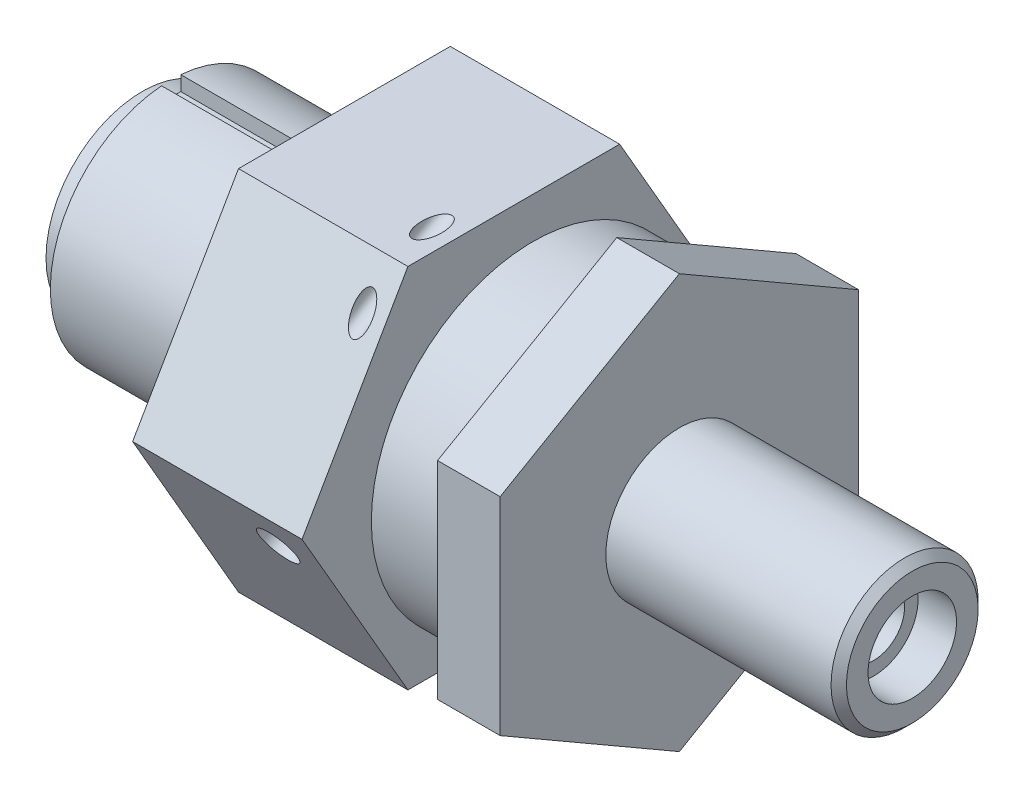
from build123d import *

# Parameters (mm, degrees)
CHAMFER1_SIZE           = 0.4
EXTRUDE1_START          = -3.25
SKETCH2_R               = 11.925743973
EXTRUDE1_DEPTH          = 3.25
EXTRUDE2_START          = -8.8
SKETCH3_R               = 13.491172398
EXTRUDE2_DEPTH          = 8.8
SKETCH4_W               = 1
SKETCH4_H               = 1.144643989
EXTRUDE3_DEPTH          = 9.5
CUT_EXTRUDE1_DEPTH      = 48.023611133
CUT_EXTRUDE1_DEPTH_BACK = 48.023611133
SKETCH5_R               = 0.520703833
SKETCH6_R               = 1.016043674
CUT_EXTRUDE2_DEPTH      = 0.5
CUT_EXTRUDE3_START      = -0.5
SKETCH7_R               = 1.016043674
CUT_EXTRUDE3_DEPTH      = 0.5


with BuildPart() as part:
    # Sketch1 → Revolve1 (revolve)
    with BuildSketch(Plane.XY, mode=Mode.PRIVATE) as revolve1_sk:
        Polygon((0, 0), (0, 5), (1.5, 5), (1.5, 6.275), (11, 6.275), (11, 8.75), (10.5, 8.75), (10.5, 11), (19.3, 11), (19.3, 6.5), (20.3, 6.5), (20.3, 8.4), (24.65, 8.4), (24.65, 10.75), (27.9, 10.75), (27.9, 3.82), (40, 3.82), (40, 2.3), (38, 2.3), (38, 1.6), (12, 1.6), (12, 0), align=None)
    revolve(revolve1_sk.sketch.rotate(Axis((0, 0, 0), (1, 0, 0)), 90), axis=Axis((0, 0, 0), (1, 0, 0)))

    # Chamfer1
    chamfer1_edges = [part.edges().sort_by_distance(p)[0] for p in [
        (40, 0, -3.82),
    ]]
    chamfer(chamfer1_edges, length=CHAMFER1_SIZE)

    # Sketch2 → Extrude1 (cut)
    with BuildSketch(Plane(origin=(27.9, 0, 0), x_dir=(0, 0, -1), z_dir=(1, 0, 0)).offset(EXTRUDE1_START)):
        Circle(SKETCH2_R)
        Polygon((0, 10.75), (-9.309773091, 5.375), (-9.309773091, -5.375), (0, -10.75), (9.309773091, -5.375), (9.309773091, 5.375), align=None, mode=Mode.SUBTRACT)
    extrude(amount=EXTRUDE1_DEPTH, mode=Mode.SUBTRACT)

    # Sketch3 → Extrude2 (cut)
    with BuildSketch(Plane(origin=(19.3, 0, 0), x_dir=(0, 0, -1), z_dir=(1, 0, 0)).offset(EXTRUDE2_START)):
        Circle(SKETCH3_R)
        Polygon((-5.5, 9.526279442), (-11, 0), (-5.5, -9.526279442), (5.5, -9.526279442), (11, 0), (5.5, 9.526279442), align=None, mode=Mode.SUBTRACT)
    extrude(amount=EXTRUDE2_DEPTH, mode=Mode.SUBTRACT)

    # Sketch4 → Extrude3 (cut)
    with BuildSketch(Plane.ZY.offset(-1.5)):
        with Locations((0, 6.063519509)):
            Rectangle(SKETCH4_W, SKETCH4_H)
    extrude(amount=-EXTRUDE3_DEPTH, mode=Mode.SUBTRACT)

    # Sketch5 → Cut-Extrude1 (cut, two sides: drawn at the far end of the back side and taken through both)
    with BuildSketch(Plane(origin=(0, -4.763139721, 8.25), x_dir=(1, 0, 0), z_dir=(0, -0.5000000000000002, 0.8660254037844386)).offset(-CUT_EXTRUDE1_DEPTH_BACK)):
        with Locations(Location((18.145997854, 9.8, 0), (0, 0, 270))):
            Circle(SKETCH5_R)
    extrude(amount=CUT_EXTRUDE1_DEPTH + CUT_EXTRUDE1_DEPTH_BACK, mode=Mode.SUBTRACT)

    # Sketch6 → Cut-Extrude2 (cut)
    with BuildSketch(Plane(origin=(0, -4.763139721, 8.25), x_dir=(1, 0, 0), z_dir=(0, -0.5000000000000002, 0.8660254037844386))):
        with Locations(Location((16.808700708, 2.994097786, 0), (0, 0, 270))):
            Circle(SKETCH6_R)
    extrude(amount=-CUT_EXTRUDE2_DEPTH, mode=Mode.SUBTRACT)

    # Sketch7 → Cut-Extrude3 (cut)
    with BuildSketch(Plane(origin=(0, 4.763139721, -8.25), x_dir=(-1, 0, 0), z_dir=(0, 0.49999999999999944, -0.8660254037844389)).offset(CUT_EXTRUDE3_START)):
        with Locations(Location((-16.808700708, 2.994097786, 0), (0, 0, 270))):
            Circle(SKETCH7_R)
    extrude(amount=CUT_EXTRUDE3_DEPTH, mode=Mode.SUBTRACT)


solid = part.part
